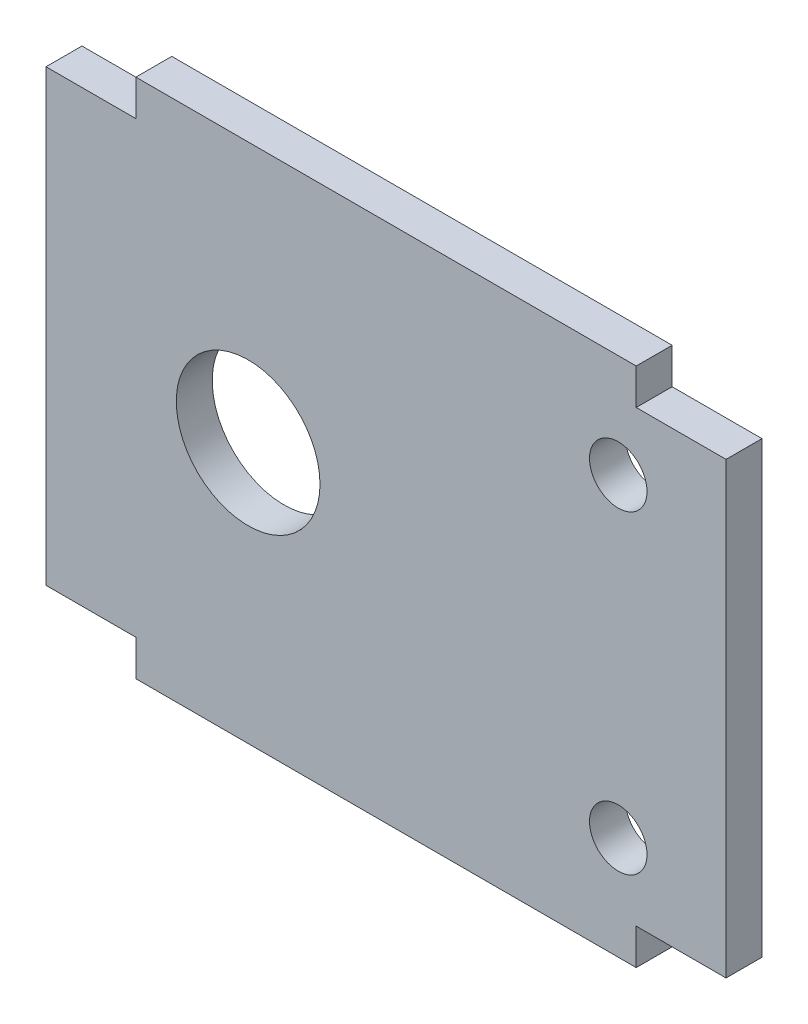
from build123d import *

# Parameters (mm, degrees)
IZIM1_W                     = 37.85
IZIM1_H                     = 25
IZIM1_R                     = 1.6
IZIM1_R_2                   = 4
Y_KSEKLIK_EKSTR_ZYON1_DEPTH = 2
IZIM2_W                     = 27.85
IZIM2_H                     = 2
Y_KSEKLIK_EKSTR_ZYON2_DEPTH = 2


with BuildPart() as part:
    # Çizim1 → Yükseklik-Ekstrüzyon1 (new body)
    with BuildSketch(Plane.XY):
        with Locations((7.675, 0)):
            Rectangle(IZIM1_W, IZIM1_H)
        with Locations((20.6, -8.75)):
            Circle(IZIM1_R, mode=Mode.SUBTRACT)
        with Locations((20.6, 8.75)):
            Circle(IZIM1_R, mode=Mode.SUBTRACT)
        Circle(IZIM1_R_2, mode=Mode.SUBTRACT)
    extrude(amount=Y_KSEKLIK_EKSTR_ZYON1_DEPTH)

    # Çizim2 → Yükseklik-Ekstrüzyon2 (add)
    with BuildSketch(Plane.XZ.offset(12.5)):
        with Locations((7.675, 1)):
            Rectangle(IZIM2_W, IZIM2_H)
    y_kseklik_ekstr_zyon2 = extrude(amount=Y_KSEKLIK_EKSTR_ZYON2_DEPTH)

    # Aynalama1: Yükseklik-Ekstrüzyon2 across plane
    add(y_kseklik_ekstr_zyon2.mirror(Plane.ZX))


solid = part.part
